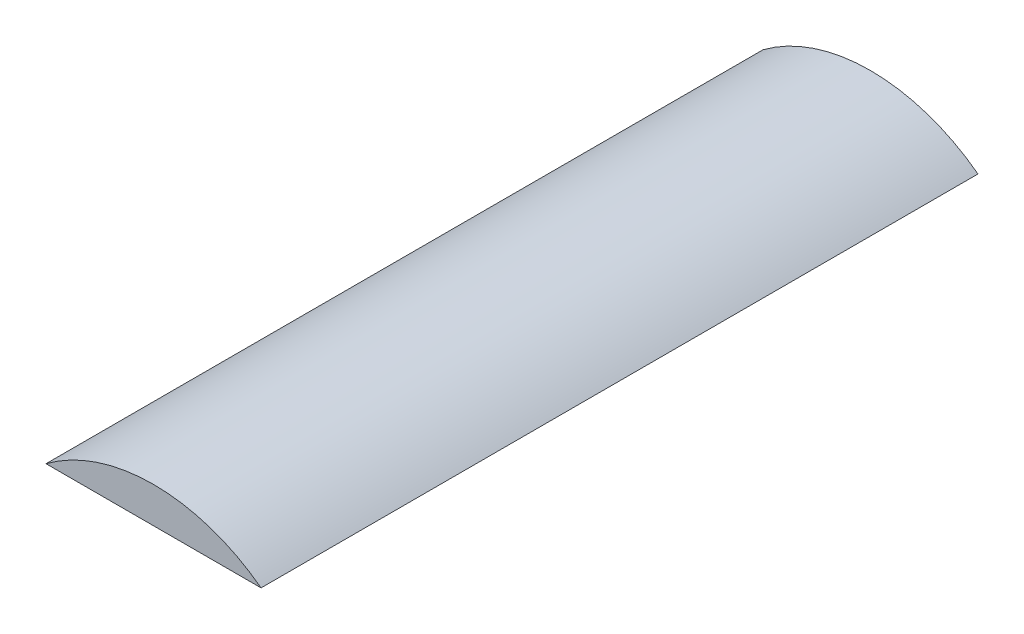
from build123d import *

# Parameters (mm, degrees)
BOSS_EXTRUDE1_DEPTH = 10


with BuildPart() as part:
    # Sketch1 → Boss-Extrude1 (new body)
    with BuildSketch(Plane.XY):
        with BuildLine():
            Line((-1.5, 2), (1.5, 2))
            ThreePointArc((1.5, 2), (0, 2.5), (-1.5, 2))
        make_face()
    extrude(amount=BOSS_EXTRUDE1_DEPTH)


solid = part.part
